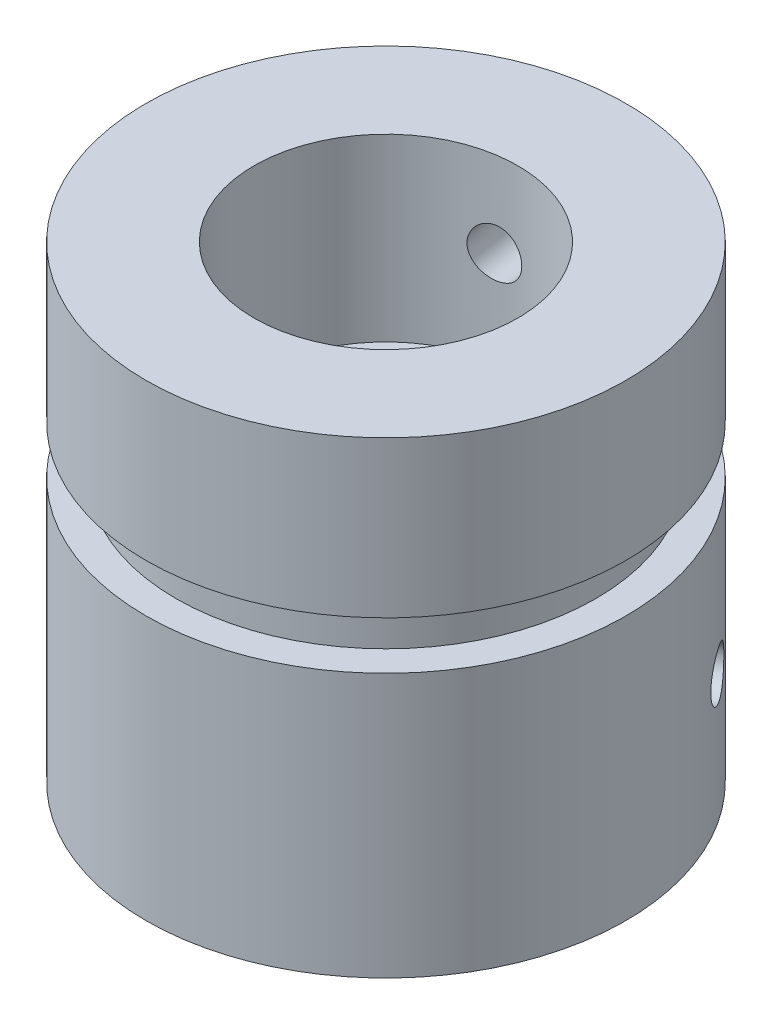
from build123d import *

# Parameters (mm, degrees)
SKETCH1_R                     = 20
SKETCH1_R_2                   = 4
BOSS_EXTRUDE1_DEPTH           = 22
SKETCH2_R                     = 17.5
SKETCH2_R_2                   = 4
BOSS_EXTRUDE2_DEPTH           = 2
SKETCH3_R                     = 17.5
SKETCH3_R_2                   = 11
BOSS_EXTRUDE3_DEPTH           = 2
SKETCH4_R                     = 20
SKETCH4_R_2                   = 11
BOSS_EXTRUDE4_DEPTH           = 13
F_4_0_4_DIAMETER_HOLE1_REACH  = 57.864
F_4_0_4_DIAMETER_HOLE1_BORE_R = 2
F_4_0_4_DIAMETER_HOLE2_REACH  = 57.96
F_4_0_4_DIAMETER_HOLE2_BORE_R = 2


with BuildPart() as part:
    # Sketch1 → Boss-Extrude1 (new body)
    with BuildSketch(Plane(origin=(0, 0, 0), x_dir=(1, 0, 0), z_dir=(0, 1, 0))):
        with Locations(Location((0, 0, 0), (0, 0, 270))):
            Circle(SKETCH1_R)
        with Locations(Location((0, 0, 0), (0, 0, 270))):
            Circle(SKETCH1_R_2, mode=Mode.SUBTRACT)
    extrude(amount=BOSS_EXTRUDE1_DEPTH)

    # Sketch2 → Boss-Extrude2 (add)
    with BuildSketch(Plane(origin=(0, 22, 0), x_dir=(1, 0, 0), z_dir=(0, 1, 0))):
        with Locations(Location((0, 0, 0), (0, 0, 270))):
            Circle(SKETCH2_R)
        with Locations(Location((0, 0, 0), (0, 0, 270))):
            Circle(SKETCH2_R_2, mode=Mode.SUBTRACT)
    extrude(amount=BOSS_EXTRUDE2_DEPTH)

    # Sketch3 → Boss-Extrude3 (add)
    with BuildSketch(Plane(origin=(0, 24, 0), x_dir=(1, 0, 0), z_dir=(0, 1, 0))):
        with Locations(Location((0, 0, 0), (0, 0, 270))):
            Circle(SKETCH3_R)
        with Locations(Location((0, 0, 0), (0, 0, 270))):
            Circle(SKETCH3_R_2, mode=Mode.SUBTRACT)
    extrude(amount=BOSS_EXTRUDE3_DEPTH)

    # Sketch4 → Boss-Extrude4 (add)
    with BuildSketch(Plane(origin=(0, 26, 0), x_dir=(1, 0, 0), z_dir=(0, 1, 0))):
        with Locations(Location((0, 0, 0), (0, 0, 270))):
            Circle(SKETCH4_R)
        with Locations(Location((0, 0, 0), (0, 0, 270))):
            Circle(SKETCH4_R_2, mode=Mode.SUBTRACT)
    extrude(amount=BOSS_EXTRUDE4_DEPTH)

    # Ø4.0 (4) Diameter Hole1 bore (on position points) → Ø4.0 (4) Diameter Hole1 (cut, up to next)
    with BuildSketch(Plane(origin=(16.590996999, 10.532581899, -11.168653391), x_dir=(0.55843266957, 0, 0.829549849953), z_dir=(0.829549849953, 0, -0.55843266957)), mode=Mode.PRIVATE) as f_4_0_4_diameter_hole1_sk1:
        Circle(F_4_0_4_DIAMETER_HOLE1_BORE_R)
    f_4_0_4_diameter_hole1_tool1 = extrude(f_4_0_4_diameter_hole1_sk1.sketch, amount=-F_4_0_4_DIAMETER_HOLE1_REACH, mode=Mode.PRIVATE) & part.part
    add(f_4_0_4_diameter_hole1_tool1.solids().sort_by_distance((16.590997, 10.532582, -11.168653))[0], mode=Mode.SUBTRACT)

    # Ø4.0 (4) Diameter Hole2 bore (on position points) → Ø4.0 (4) Diameter Hole2 (cut, up to next)
    with BuildSketch(Plane(origin=(-3.052461352, 31.918352454, -19.765689457), x_dir=(-0.98828447283, 0, 0.152623067601), z_dir=(-0.152623067601, 0, -0.98828447283)), mode=Mode.PRIVATE) as f_4_0_4_diameter_hole2_sk1:
        Circle(F_4_0_4_DIAMETER_HOLE2_BORE_R)
    f_4_0_4_diameter_hole2_tool1 = extrude(f_4_0_4_diameter_hole2_sk1.sketch, amount=-F_4_0_4_DIAMETER_HOLE2_REACH, mode=Mode.PRIVATE) & part.part
    add(f_4_0_4_diameter_hole2_tool1.solids().sort_by_distance((-3.052461, 31.918352, -19.765689))[0], mode=Mode.SUBTRACT)


solid = part.part
